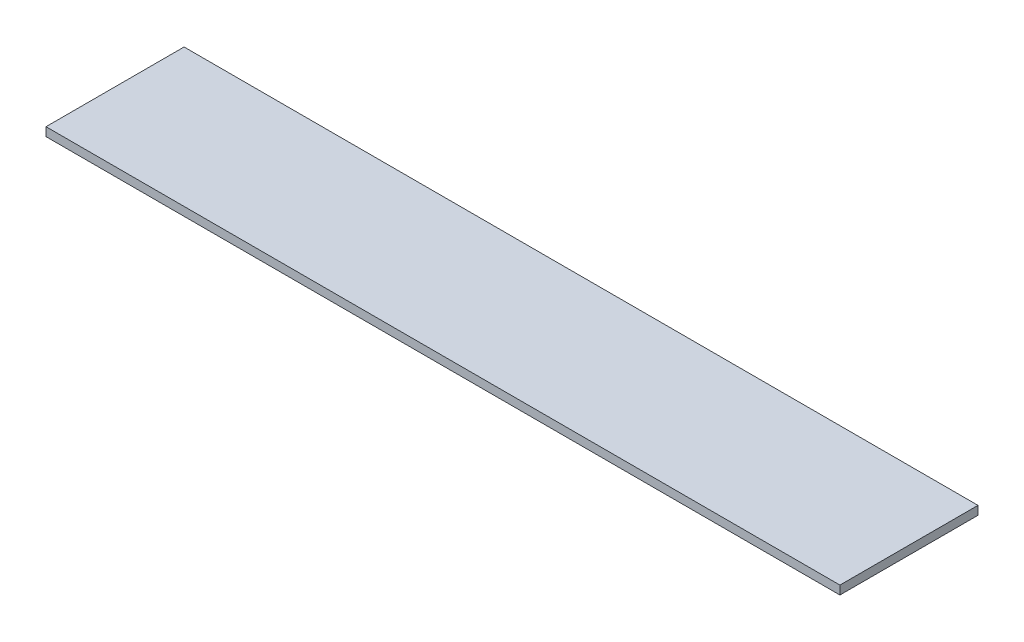
from build123d import *

# Parameters (mm, degrees)
SKETCH1_W           = 292.1
SKETCH1_H           = 50.8
BOSS_EXTRUDE1_DEPTH = 3.175


with BuildPart() as part:
    # Sketch1 → Boss-Extrude1 (new body)
    with BuildSketch(Plane(origin=(0, 0, 0), x_dir=(1, 0, 0), z_dir=(0, 1, 0))):
        with Locations((146.05, -25.4)):
            Rectangle(SKETCH1_W, SKETCH1_H)
    extrude(amount=BOSS_EXTRUDE1_DEPTH)


solid = part.part
